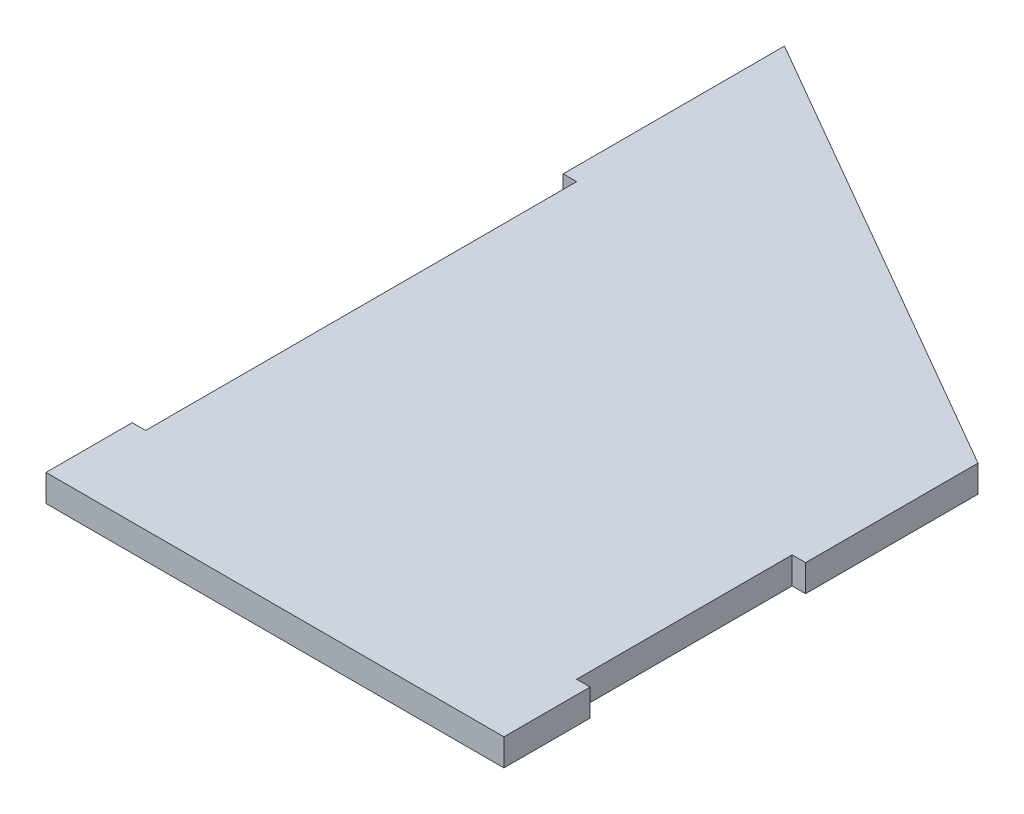
from build123d import *

# Parameters (mm, degrees)
BOSS_EXTRUDE1_DEPTH = 1.5875


with BuildPart() as part:
    # Sketch1 → Boss-Extrude1 (new body)
    with BuildSketch(Plane(origin=(0, 0, 0), x_dir=(1, 0, 0), z_dir=(0, 1, 0))):
        Polygon((-13.49375, -8.89), (-13.49375, -13.97), (13.49375, -13.97), (13.49375, -8.89), (12.7, -8.89), (12.7, 3.81), (13.49375, 3.81), (13.49375, 13.97), (-13.49375, 29.55124039), (-13.49375, 16.51), (-12.7, 16.51), (-12.7, -8.89), align=None)
    extrude(amount=BOSS_EXTRUDE1_DEPTH)


solid = part.part
